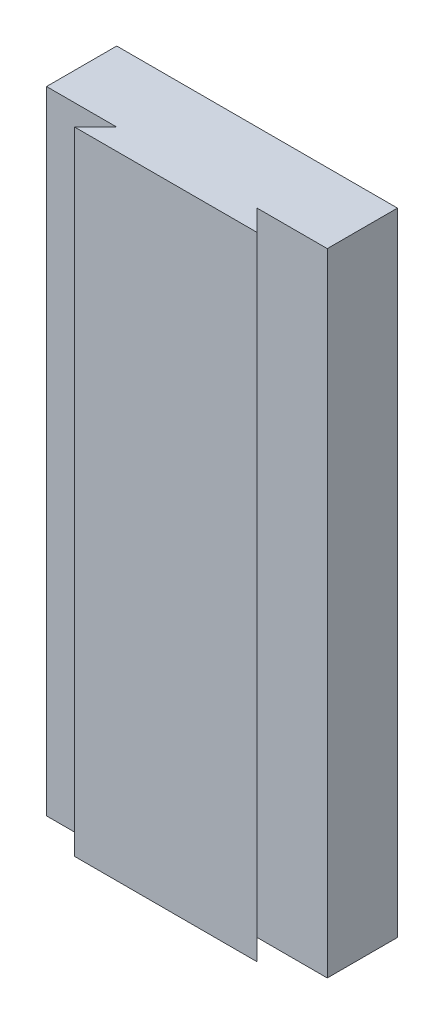
from build123d import *

# Parameters (mm, degrees)
SKETCH_1_W      = 40
SKETCH_1_H      = 90
EXTRUDE_1_DEPTH = 10
EXTRUDE_2_DEPTH = 90


with BuildPart() as part:
    # 草图1 → 凸台-拉伸1 (new body)
    with BuildSketch(Plane.XY):
        with Locations((20, -45)):
            Rectangle(SKETCH_1_W, SKETCH_1_H)
    extrude(amount=EXTRUDE_1_DEPTH)

    # 草图2 → 凸台-拉伸2 (add)
    with BuildSketch(Plane.XZ.offset(90)):
        Polygon((10, 10), (7, 13), (33, 13), (30, 10), align=None)
    extrude(amount=-EXTRUDE_2_DEPTH)


solid = part.part
